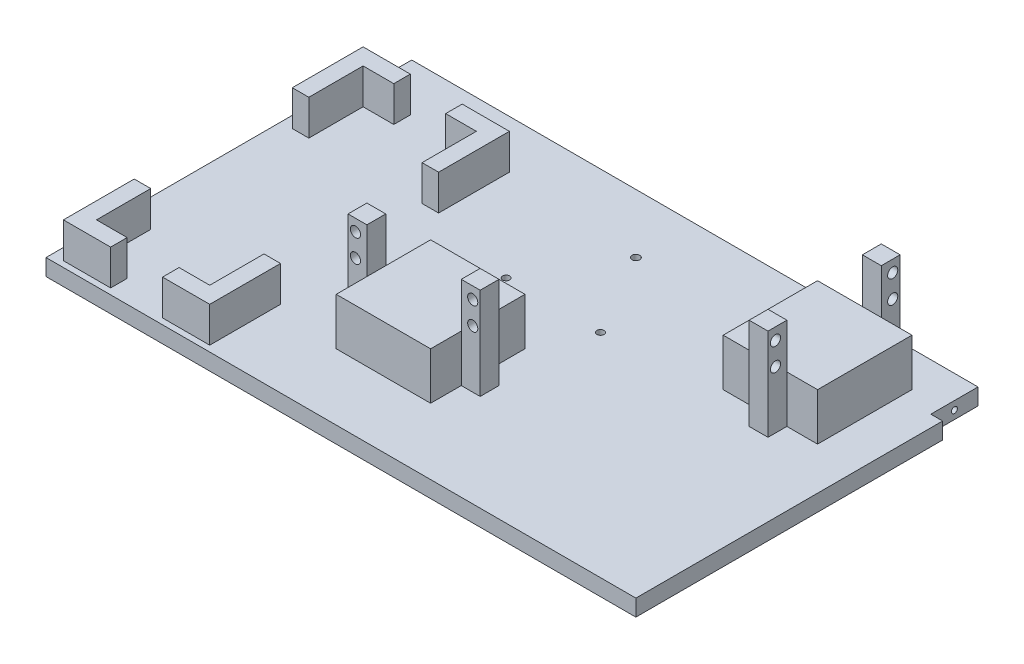
from build123d import *

# Parameters (mm, degrees)
SKIZZE1_W                             = 250
SKIZZE1_H                             = 250
AUFSATZ_LINEAR_AUSTRAGEN1_DEPTH       = 5
SKIZZE2_W                             = 40
SKIZZE2_H                             = 40
AUFSATZ_LINEAR_AUSTRAGEN2_DEPTH       = 15
SKIZZE3_R                             = 1.65
SKIZZE3_W                             = 30
SKIZZE3_H                             = 30
SCHNITT_LINEAR_AUSTRAGEN1_DEPTH       = 15
SKIZZE4_R                             = 1.65
SKIZZE4_W                             = 30
SKIZZE4_H                             = 30
SCHNITT_LINEAR_AUSTRAGEN2_DEPTH       = 15
SKIZZE6_W                             = 40
SKIZZE6_H                             = 40
AUFSATZ_LINEAR_AUSTRAGEN3_DEPTH       = 5
SKIZZE7_W                             = 40
SKIZZE7_H                             = 40
SCHNITT_LINEAR_AUSTRAGEN3_DEPTH       = 43
SKIZZE8_W                             = 30
SKIZZE8_H                             = 30
AUFSATZ_LINEAR_AUSTRAGEN4_DEPTH       = 5
SKIZZE9_W                             = 45
SKIZZE9_H                             = 45
AUFSATZ_LINEAR_AUSTRAGEN5_DEPTH       = 15
SKIZZE10_W                            = 8
SKIZZE10_H                            = 8
AUFSATZ_LINEAR_AUSTRAGEN6_DEPTH       = 34
SKIZZE11_R                            = 2.15
SCHNITT_LINEAR_AUSTRAGEN4_DEPTH       = 34
SKIZZE12_W                            = 143.062860871
SKIZZE12_H                            = 184.486429343
SCHNITT_LINEAR_AUSTRAGEN5_DEPTH       = 60
SKIZZE13_W                            = 40
SKIZZE13_H                            = 40
AUFSATZ_LINEAR_AUSTRAGEN7_DEPTH       = 15
SKIZZE14_W                            = 8
SKIZZE14_H                            = 8
AUFSATZ_LINEAR_AUSTRAGEN8_DEPTH       = 34
SKIZZE15_W                            = 37
SKIZZE15_H                            = 14
SCHNITT_LINEAR_AUSTRAGEN6_DEPTH       = 10
SKIZZE16_W                            = 50
SKIZZE16_H                            = 70
AUFSATZ_LINEAR_AUSTRAGEN9_DEPTH       = 1
SKIZZE17_R                            = 1.35
SCHNITT_LINEAR_AUSTRAGEN7_DEPTH       = 21
SKIZZE18_R                            = 2.15
SCHNITT_LINEAR_AUSTRAGEN8_DEPTH       = 21
SKIZZE19_R                            = 2.15
SCHNITT_LINEAR_AUSTRAGEN9_DEPTH       = 21
SCHNITT_LINEAR_AUSTRAGEN10_DEPTH      = 22
SCHNITT_LINEAR_AUSTRAGEN10_DEPTH_BACK = 63
SKIZZE20_W                            = 250
SKIZZE20_H                            = 100
SKIZZE21_W                            = 5
SKIZZE21_H                            = 20
SCHNITT_LINEAR_AUSTRAGEN11_DEPTH      = 10
SKIZZE22_R                            = 1.25
SCHNITT_LINEAR_AUSTRAGEN12_DEPTH      = 20
SCHNITT_LINEAR_START                  = -20
SKIZZE23_R                            = 1.25
SCHNITT_LINEAR_AUSTRAGEN13_DEPTH      = 20
SKIZZE24_R                            = 1.5
SCHNITT_LINEAR_AUSTRAGEN15_DEPTH      = 10
SKIZZE25_W                            = 240
SKIZZE25_H                            = 20
SKIZZE25_R                            = 1.5
SKIZZE25_R_2                          = 1.65
AUFSATZ_LINEAR_AUSTRAGEN10_DEPTH      = 2
SKIZZE26_W                            = 48
SKIZZE26_H                            = 113
SCHNITT_LINEAR_AUSTRAGEN17_DEPTH      = 15
SKIZZE27_W                            = 40
SKIZZE27_H                            = 40
AUFSATZ_LINEAR_AUSTRAGEN11_DEPTH      = 4
SKIZZE28_W                            = 8
SKIZZE28_H                            = 8
AUFSATZ_LINEAR_AUSTRAGEN12_DEPTH      = 4
SKIZZE30_R                            = 2.15
SCHNITT_LINEAR_AUSTRAGEN18_DEPTH      = 9
SKIZZE31_R                            = 2.15
SCHNITT_LINEAR_AUSTRAGEN19_DEPTH      = 9
SKIZZE32_R                            = 2.15
SCHNITT_LINEAR_AUSTRAGEN20_DEPTH      = 9
SKIZZE33_W                            = 40
SKIZZE33_H                            = 40
AUFSATZ_LINEAR_AUSTRAGEN13_DEPTH      = 1
SKIZZE34_W                            = 8
SKIZZE34_H                            = 8
AUFSATZ_LINEAR_AUSTRAGEN14_DEPTH      = 1


with BuildPart() as part:
    # Skizze1 → Aufsatz-Linear austragen1 (new body)
    with BuildSketch(Plane(origin=(0, 0, 0), x_dir=(1, 0, 0), z_dir=(0, 1, 0))):
        Rectangle(SKIZZE1_W, SKIZZE1_H)
    extrude(amount=AUFSATZ_LINEAR_AUSTRAGEN1_DEPTH)

    # Skizze2 → Aufsatz-Linear austragen2 (add)
    with BuildSketch(Plane(origin=(0, 5, 0), x_dir=(1, 0, 0), z_dir=(0, 1, 0))):
        Polygon((-100.127507589, -114.480956566), (-112.127507589, -114.480956566), (-112.127507589, -92.480956566), (-120.127507589, -92.480956566), (-120.127507589, -122.480956566), (-100.127507589, -122.480956566), align=None)
        Polygon((-66.127507589, -114.480956566), (-78.127507589, -114.480956566), (-78.127507589, -122.480956566), (-58.127507589, -122.480956566), (-58.127507589, -92.480956566), (-66.127507589, -92.480956566), align=None)
        Polygon((-66.127507589, -3.480956566), (-66.127507589, -25.480956566), (-58.127507589, -25.480956566), (-58.127507589, 4.519043434), (-78.127507589, 4.519043434), (-78.127507589, -3.480956566), align=None)
        Polygon((-120.127507589, -25.480956566), (-112.127507589, -25.480956566), (-112.127507589, -3.480956566), (-100.127507589, -3.480956566), (-100.127507589, 4.519043434), (-120.127507589, 4.519043434), align=None)
        with Locations((0, -85)):
            Rectangle(SKIZZE2_W, SKIZZE2_H)
        with Locations((85, 0)):
            Rectangle(SKIZZE2_W, SKIZZE2_H)
    extrude(amount=AUFSATZ_LINEAR_AUSTRAGEN2_DEPTH)

    # Skizze3 → Schnitt-Linear austragen1 (cut)
    with BuildSketch(Plane(origin=(0, 20, 0), x_dir=(1, 0, 0), z_dir=(0, 1, 0))):
        Circle(SKIZZE3_R)
        with Locations((85, 0)):
            Rectangle(SKIZZE3_W, SKIZZE3_H)
        with Locations((0, -85)):
            Rectangle(SKIZZE3_W, SKIZZE3_H)
    extrude(amount=-SCHNITT_LINEAR_AUSTRAGEN1_DEPTH, mode=Mode.SUBTRACT)

    # Skizze4 → Schnitt-Linear austragen2 (cut)
    with BuildSketch(Plane(origin=(0, 5, 0), x_dir=(1, 0, 0), z_dir=(0, 1, 0))):
        with Locations(Location((0, 0, 0), (0, 0, 270))):
            Circle(SKIZZE4_R)
        with Locations((0, -85)):
            Rectangle(SKIZZE4_W, SKIZZE4_H)
        with Locations((85, 0)):
            Rectangle(SKIZZE4_W, SKIZZE4_H)
    extrude(amount=-SCHNITT_LINEAR_AUSTRAGEN2_DEPTH, mode=Mode.SUBTRACT)

    # Skizze6 → Aufsatz-Linear austragen3 (add)
    with BuildSketch(Plane(origin=(0, 20, 0), x_dir=(1, 0, 0), z_dir=(0, 1, 0))):
        with Locations((0, -85)):
            Rectangle(SKIZZE6_W, SKIZZE6_H)
        with Locations((85, 0)):
            Rectangle(SKIZZE6_W, SKIZZE6_H)
    extrude(amount=-AUFSATZ_LINEAR_AUSTRAGEN3_DEPTH)

    # Skizze7 → Schnitt-Linear austragen3 (cut)
    with BuildSketch(Plane(origin=(0, 5, 0), x_dir=(1, 0, 0), z_dir=(0, 1, 0))):
        with Locations((0, -85)):
            Rectangle(SKIZZE7_W, SKIZZE7_H)
        with Locations((85, 0)):
            Rectangle(SKIZZE7_W, SKIZZE7_H)
    extrude(amount=SCHNITT_LINEAR_AUSTRAGEN3_DEPTH, mode=Mode.SUBTRACT)

    # Skizze8 → Aufsatz-Linear austragen4 (add)
    with BuildSketch(Plane(origin=(0, 5, 0), x_dir=(1, 0, 0), z_dir=(0, 1, 0))):
        with Locations((0, -85)):
            Rectangle(SKIZZE8_W, SKIZZE8_H)
        with Locations((85, 0)):
            Rectangle(SKIZZE8_W, SKIZZE8_H)
    extrude(amount=-AUFSATZ_LINEAR_AUSTRAGEN4_DEPTH)

    # Skizze9 → Aufsatz-Linear austragen5 (add)
    with BuildSketch(Plane(origin=(0, 5, 0), x_dir=(1, 0, 0), z_dir=(0, 1, 0))):
        with Locations((16.5, -93.5)):
            Rectangle(SKIZZE9_W, SKIZZE9_H)
        with Locations((93.5, -16.5)):
            Rectangle(SKIZZE9_W, SKIZZE9_H)
    extrude(amount=AUFSATZ_LINEAR_AUSTRAGEN5_DEPTH)

    # Skizze10 → Aufsatz-Linear austragen6 (add)
    with BuildSketch(Plane(origin=(0, 5, 0), x_dir=(1, 0, 0), z_dir=(0, 1, 0))):
        with Locations((-10, -89)):
            Rectangle(SKIZZE10_W, SKIZZE10_H)
        with Locations((43, -89)):
            Rectangle(SKIZZE10_W, SKIZZE10_H)
        with Locations((89, 10)):
            Rectangle(SKIZZE10_W, SKIZZE10_H)
        with Locations((89, -43)):
            Rectangle(SKIZZE10_W, SKIZZE10_H)
    extrude(amount=AUFSATZ_LINEAR_AUSTRAGEN6_DEPTH)

    # Skizze11 → Schnitt-Linear austragen4 (cut)
    with BuildSketch(Plane(origin=(0, 0, 85), x_dir=(-1, 0, 0), z_dir=(0, 0, -1))):
        with Locations((10.85, 34.05)):
            Circle(SKIZZE11_R)
        with Locations((10.85, 24.35)):
            Circle(SKIZZE11_R)
        with Locations((-43.85, 34.05)):
            Circle(SKIZZE11_R)
        with Locations((-43.85, 24.35)):
            Circle(SKIZZE11_R)
    extrude(amount=-SCHNITT_LINEAR_AUSTRAGEN4_DEPTH, mode=Mode.SUBTRACT)

    # Skizze12 → Schnitt-Linear austragen5 (cut)
    with BuildSketch(Plane(origin=(0, 5, 0), x_dir=(1, 0, 0), z_dir=(0, 1, 0))):
        with Locations((48.924998025, -26.491593456)):
            Rectangle(SKIZZE12_W, SKIZZE12_H)
    extrude(amount=SCHNITT_LINEAR_AUSTRAGEN5_DEPTH, mode=Mode.SUBTRACT)

    # Skizze13 → Aufsatz-Linear austragen7 (add)
    with BuildSketch(Plane(origin=(0, 5, 0), x_dir=(1, 0, 0), z_dir=(0, 1, 0))):
        with Locations((-10, -77)):
            Rectangle(SKIZZE13_W, SKIZZE13_H)
        with Locations((87, -10)):
            Rectangle(SKIZZE13_W, SKIZZE13_H)
    extrude(amount=AUFSATZ_LINEAR_AUSTRAGEN7_DEPTH)

    # Skizze14 → Aufsatz-Linear austragen8 (add)
    with BuildSketch(Plane(origin=(0, 5, 0), x_dir=(1, 0, 0), z_dir=(0, 1, 0))):
        with Locations((-34, -80)):
            Rectangle(SKIZZE14_W, SKIZZE14_H)
        with Locations((14, -80)):
            Rectangle(SKIZZE14_W, SKIZZE14_H)
        with Locations((90, -34)):
            Rectangle(SKIZZE14_W, SKIZZE14_H)
        with Locations((90, 14)):
            Rectangle(SKIZZE14_W, SKIZZE14_H)
    extrude(amount=AUFSATZ_LINEAR_AUSTRAGEN8_DEPTH)

    # Skizze15 → Schnitt-Linear austragen6 (cut)
    with BuildSketch(Plane(origin=(0, 5, 0), x_dir=(1, 0, 0), z_dir=(0, 1, 0))):
        with Locations((0, 118)):
            Rectangle(SKIZZE15_W, SKIZZE15_H)
    extrude(amount=-SCHNITT_LINEAR_AUSTRAGEN6_DEPTH, mode=Mode.SUBTRACT)

    # Skizze16 → Aufsatz-Linear austragen9 (add)
    with BuildSketch(Plane(origin=(0, 5, 0), x_dir=(1, 0, 0), z_dir=(0, 1, 0))):
        with Locations((-76.733084372, 76.985715353)):
            Rectangle(SKIZZE16_W, SKIZZE16_H)
    extrude(amount=AUFSATZ_LINEAR_AUSTRAGEN9_DEPTH)

    # Skizze17 → Schnitt-Linear austragen7 (cut)
    with BuildSketch(Plane(origin=(0, 5, 0), x_dir=(1, 0, 0), z_dir=(0, 1, 0))):
        with Locations(Location((105.951755746, 46.286528094, 0), (0, 0, 270))):
            Circle(SKIZZE17_R)
        with Locations(Location((105.951755746, 95.286528094, 0), (0, 0, 270))):
            Circle(SKIZZE17_R)
        with Locations(Location((47.951755746, 46.286528094, 0), (0, 0, 270))):
            Circle(SKIZZE17_R)
        with Locations(Location((47.951755746, 95.286528094, 0), (0, 0, 270))):
            Circle(SKIZZE17_R)
    extrude(amount=-SCHNITT_LINEAR_AUSTRAGEN7_DEPTH, mode=Mode.SUBTRACT)

    # Skizze18 → Schnitt-Linear austragen8 (cut)
    with BuildSketch(Plane(origin=(0, 0, 76), x_dir=(-1, 0, 0), z_dir=(0, 0, -1))):
        with Locations((34.85, 39.05)):
            Circle(SKIZZE18_R)
        with Locations((34.85, 29.35)):
            Circle(SKIZZE18_R)
        with Locations((-14.85, 39.05)):
            Circle(SKIZZE18_R)
        with Locations((-14.85, 29.35)):
            Circle(SKIZZE18_R)
    extrude(amount=-SCHNITT_LINEAR_AUSTRAGEN8_DEPTH, mode=Mode.SUBTRACT)

    # Skizze19 → Schnitt-Linear austragen9 (cut)
    with BuildSketch(Plane.ZY.offset(-86)):
        with Locations((34.836277026, 39.05)):
            Circle(SKIZZE19_R)
        with Locations((34.836277026, 29.35)):
            Circle(SKIZZE19_R)
        with Locations((-14.85, 39.05)):
            Circle(SKIZZE19_R)
        with Locations((-14.85, 29.35)):
            Circle(SKIZZE19_R)
    extrude(amount=-SCHNITT_LINEAR_AUSTRAGEN9_DEPTH, mode=Mode.SUBTRACT)

    # Skizze20 → Schnitt-Linear austragen10 (cut, two sides: drawn at the far end of the back side and taken through both)
    with BuildSketch(Plane(origin=(0, 5, 0), x_dir=(1, 0, 0), z_dir=(0, 1, 0)).offset(-SCHNITT_LINEAR_AUSTRAGEN10_DEPTH_BACK)):
        with Locations((0, 75)):
            Rectangle(SKIZZE20_W, SKIZZE20_H)
    extrude(amount=SCHNITT_LINEAR_AUSTRAGEN10_DEPTH + SCHNITT_LINEAR_AUSTRAGEN10_DEPTH_BACK, mode=Mode.SUBTRACT)

    # Skizze21 → Schnitt-Linear austragen11 (cut)
    with BuildSketch(Plane(origin=(0, 5, 0), x_dir=(1, 0, 0), z_dir=(0, 1, 0))):
        with Locations((-122.5, 15)):
            Rectangle(SKIZZE21_W, SKIZZE21_H)
        with Locations((122.5, 15)):
            Rectangle(SKIZZE21_W, SKIZZE21_H)
    extrude(amount=-SCHNITT_LINEAR_AUSTRAGEN11_DEPTH, mode=Mode.SUBTRACT)

    # Skizze22 → Schnitt-Linear austragen12 (cut)
    with BuildSketch(Plane.ZY.offset(120)):
        with Locations((-15, 1.5)):
            Circle(SKIZZE22_R)
    extrude(amount=-SCHNITT_LINEAR_AUSTRAGEN12_DEPTH, mode=Mode.SUBTRACT)

    # Skizze23 → Schnitt-Linear austragen13 (cut)
    with BuildSketch(Plane(origin=(120, 0, 0), x_dir=(0, 0, -1), z_dir=(1, 0, 0)).offset(SCHNITT_LINEAR_START)):
        with Locations(Location((15, 1.5, 0), (0, 0, 180))):
            Circle(SKIZZE23_R)
    extrude(amount=SCHNITT_LINEAR_AUSTRAGEN13_DEPTH, mode=Mode.SUBTRACT)

    # Skizze24 → Schnitt-Linear austragen15 (cut)
    with BuildSketch(Plane(origin=(0, 5, 0), x_dir=(1, 0, 0), z_dir=(0, 1, 0))):
        with Locations(Location((-20, -35, 0), (0, 0, 270))):
            Circle(SKIZZE24_R)
        with Locations(Location((20, -35, 0), (0, 0, 270))):
            Circle(SKIZZE24_R)
    extrude(amount=-SCHNITT_LINEAR_AUSTRAGEN15_DEPTH, mode=Mode.SUBTRACT)

    # Skizze25 → Aufsatz-Linear austragen10 (add)
    # profile 1 of 2: a face of its own
    with BuildSketch(Plane.XZ):
        with Locations((0, -15)):
            Rectangle(SKIZZE25_W, SKIZZE25_H)
    # profile 2 of 2: a face of its own
    with BuildSketch(Plane.XZ):
        Polygon((125, -5), (125, 125), (-125, 125), (-125, -5), (-120, -5), (120, -5), align=None)
        with Locations(Location((-20, 35, 0), (0, 0, 90))):
            Circle(SKIZZE25_R, mode=Mode.SUBTRACT)
        with Locations(Location((0, 0, 0), (0, 0, 90))):
            Circle(SKIZZE25_R_2, mode=Mode.SUBTRACT)
        with Locations(Location((20, 35, 0), (0, 0, 90))):
            Circle(SKIZZE25_R, mode=Mode.SUBTRACT)
    extrude(amount=AUFSATZ_LINEAR_AUSTRAGEN10_DEPTH)

    # Skizze26 → Schnitt-Linear austragen17 (cut)
    with BuildSketch(Plane(origin=(0, 20, 0), x_dir=(1, 0, 0), z_dir=(0, 1, 0))):
        with Locations((-89.127507589, -58.980956566)):
            Rectangle(SKIZZE26_W, SKIZZE26_H)
    extrude(amount=-SCHNITT_LINEAR_AUSTRAGEN17_DEPTH, mode=Mode.SUBTRACT)

    # Skizze27 → Aufsatz-Linear austragen11 (add)
    with BuildSketch(Plane(origin=(0, 20, 0), x_dir=(1, 0, 0), z_dir=(0, 1, 0))):
        with Locations((87, -10)):
            Rectangle(SKIZZE27_W, SKIZZE27_H)
        with Locations((-10, -77)):
            Rectangle(SKIZZE27_W, SKIZZE27_H)
    extrude(amount=AUFSATZ_LINEAR_AUSTRAGEN11_DEPTH)

    # Skizze28 → Aufsatz-Linear austragen12 (add)
    with BuildSketch(Plane(origin=(0, 39, 0), x_dir=(1, 0, 0), z_dir=(0, 1, 0))):
        with Locations((14, -80)):
            Rectangle(SKIZZE28_W, SKIZZE28_H)
        with Locations((-34, -80)):
            Rectangle(SKIZZE28_W, SKIZZE28_H)
        with Locations((90, -34)):
            Rectangle(SKIZZE28_W, SKIZZE28_H)
        with Locations((90, 14)):
            Rectangle(SKIZZE28_W, SKIZZE28_H)
    extrude(amount=AUFSATZ_LINEAR_AUSTRAGEN12_DEPTH)

    # Skizze30 → Schnitt-Linear austragen18 (cut)
    with BuildSketch(Plane.ZY.offset(-86)):
        with Locations((34.836277026, 39)):
            Circle(SKIZZE30_R)
    extrude(amount=-SCHNITT_LINEAR_AUSTRAGEN18_DEPTH, mode=Mode.SUBTRACT)

    # Skizze31 → Schnitt-Linear austragen19 (cut)
    with BuildSketch(Plane.ZY.offset(-86)):
        with Locations((-14.85, 39)):
            Circle(SKIZZE31_R)
    extrude(amount=-SCHNITT_LINEAR_AUSTRAGEN19_DEPTH, mode=Mode.SUBTRACT)

    # Skizze32 → Schnitt-Linear austragen20 (cut)
    with BuildSketch(Plane(origin=(0, 0, 76), x_dir=(-1, 0, 0), z_dir=(0, 0, -1))):
        with Locations((-14.85, 39)):
            Circle(SKIZZE32_R)
        with Locations((34.85, 39)):
            Circle(SKIZZE32_R)
    extrude(amount=-SCHNITT_LINEAR_AUSTRAGEN20_DEPTH, mode=Mode.SUBTRACT)

    # Skizze33 → Aufsatz-Linear austragen13 (add)
    with BuildSketch(Plane(origin=(0, 24, 0), x_dir=(1, 0, 0), z_dir=(0, 1, 0))):
        with Locations((-10, -77)):
            Rectangle(SKIZZE33_W, SKIZZE33_H)
        with Locations((87, -10)):
            Rectangle(SKIZZE33_W, SKIZZE33_H)
    extrude(amount=AUFSATZ_LINEAR_AUSTRAGEN13_DEPTH)

    # Skizze34 → Aufsatz-Linear austragen14 (add)
    with BuildSketch(Plane(origin=(0, 43, 0), x_dir=(1, 0, 0), z_dir=(0, 1, 0))):
        with Locations((-34, -80)):
            Rectangle(SKIZZE34_W, SKIZZE34_H)
        with Locations((14, -80)):
            Rectangle(SKIZZE34_W, SKIZZE34_H)
        with Locations((90, -34)):
            Rectangle(SKIZZE34_W, SKIZZE34_H)
        with Locations((90, 14)):
            Rectangle(SKIZZE34_W, SKIZZE34_H)
    extrude(amount=AUFSATZ_LINEAR_AUSTRAGEN14_DEPTH)


solid = part.part
